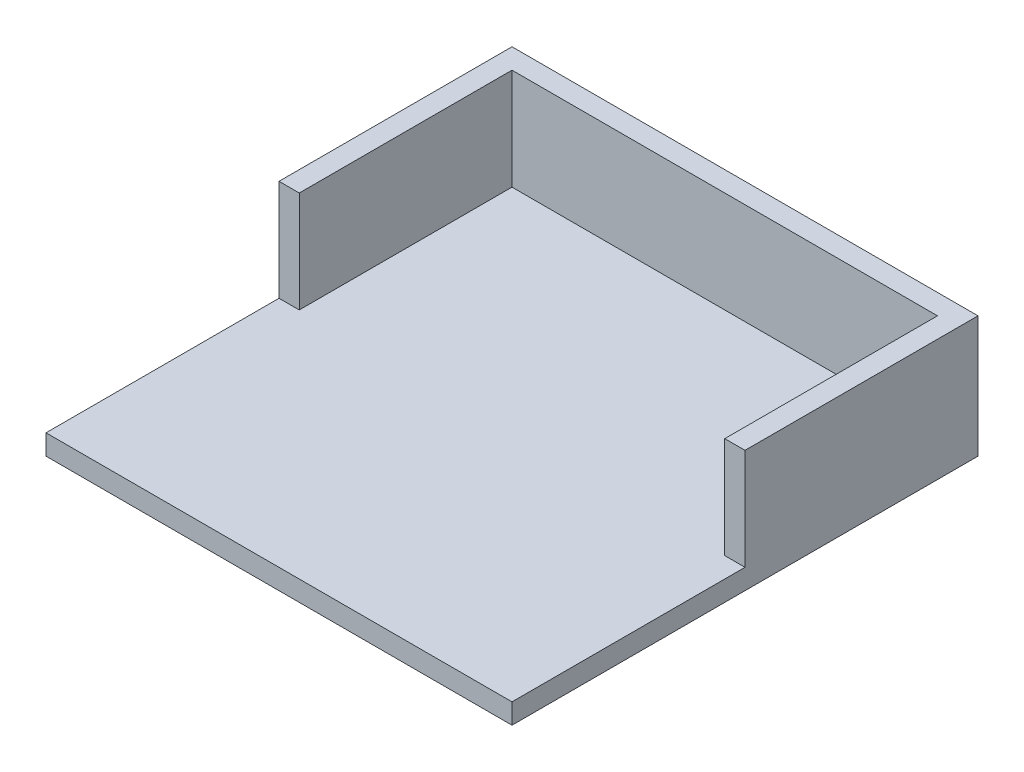
from build123d import *

# Parameters (mm, degrees)
SKETCH1_W           = 46
SKETCH1_H           = 46
BOSS_EXTRUDE1_DEPTH = 2
SKETCH2_W           = 46
SKETCH2_H           = 46
SKETCH2_W_2         = 42
SKETCH2_H_2         = 42
BOSS_EXTRUDE2_DEPTH = 10
SKETCH3_W           = 46
SKETCH3_H           = 23
CUT_EXTRUDE1_DEPTH  = 10


with BuildPart() as part:
    # Sketch1 → Boss-Extrude1 (new body)
    with BuildSketch(Plane(origin=(0, 0, 0), x_dir=(1, 0, 0), z_dir=(0, 1, 0))):
        with Locations((23, 23)):
            Rectangle(SKETCH1_W, SKETCH1_H)
    extrude(amount=BOSS_EXTRUDE1_DEPTH)

    # Sketch2 → Boss-Extrude2 (add)
    with BuildSketch(Plane(origin=(0, 2, 0), x_dir=(1, 0, 0), z_dir=(0, 1, 0))):
        with Locations((23, 23)):
            Rectangle(SKETCH2_W, SKETCH2_H)
        with Locations((23, 23)):
            Rectangle(SKETCH2_W_2, SKETCH2_H_2, mode=Mode.SUBTRACT)
    extrude(amount=BOSS_EXTRUDE2_DEPTH)

    # Sketch3 → Cut-Extrude1 (cut)
    with BuildSketch(Plane(origin=(0, 12, 0), x_dir=(1, 0, 0), z_dir=(0, 1, 0))):
        with Locations((23, 11.5)):
            Rectangle(SKETCH3_W, SKETCH3_H)
    extrude(amount=-CUT_EXTRUDE1_DEPTH, mode=Mode.SUBTRACT)


solid = part.part
